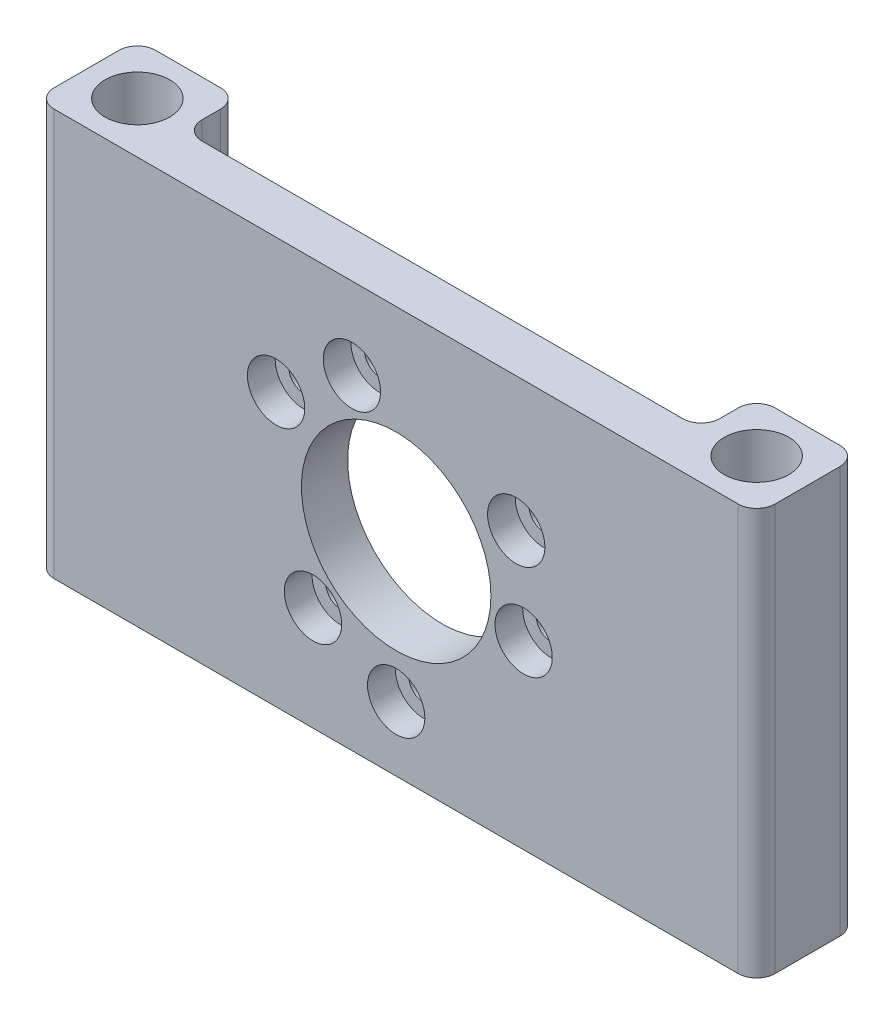
from build123d import *

# Parameters (mm, degrees)
ESQUISSE3_R                  = 3.5
BOSS_EXTRU_1_DEPTH           = 44
ESQUISSE4_R                  = 10.25
ESQUISSE4_R_2                = 1.625
ENL_V_MAT_EXTRU_1_DEPTH      = 60
ENL_V_MAT_EXTRU_2_DEPTH      = 60.816385715
ENL_V_MAT_EXTRU_2_DEPTH_BACK = 3
ESQUISSE6_R                  = 3.1


with BuildPart() as part:
    # Esquisse3 → Boss.-Extru.1 (new body)
    with BuildSketch(Plane(origin=(0, 0, 0), x_dir=(1, 0, 0), z_dir=(0, 1, 0))):
        with BuildLine():
            Line((26, 0), (-26, 0))
            ThreePointArc((-26, 0), (-27.414213562, 0.585786438), (-28, 2))
            Line((-28, 2), (-28, 4))
            ThreePointArc((-28, 4), (-28.585786438, 5.414213562), (-30, 6))
            Line((-30, 6), (-37, 6))
            ThreePointArc((-37, 6), (-38.414213562, 5.414213562), (-39, 4))
            Line((-39, 4), (-39, -3))
            ThreePointArc((-39, -3), (-38.414213562, -4.414213562), (-37, -5))
            Line((-37, -5), (37, -5))
            ThreePointArc((37, -5), (38.414213562, -4.414213562), (39, -3))
            Line((39, -3), (39, 4))
            ThreePointArc((39, 4), (38.414213562, 5.414213562), (37, 6))
            Line((37, 6), (30, 6))
            ThreePointArc((30, 6), (28.585786438, 5.414213562), (28, 4))
            Line((28, 4), (28, 2))
            ThreePointArc((28, 2), (27.414213562, 0.585786438), (26, 0))
        make_face()
        with Locations(Location((-33.5, 0.5, 0), (0, 0, 270))):
            Circle(ESQUISSE3_R, mode=Mode.SUBTRACT)
        with Locations(Location((33.5, 0.5, 0), (0, 0, 90))):
            Circle(ESQUISSE3_R, mode=Mode.SUBTRACT)
    extrude(amount=BOSS_EXTRU_1_DEPTH)

    # Esquisse4 → Enlèv. mat.-Extru.1 (cut)
    with BuildSketch(Plane.XY.offset(5)):
        with Locations((0, 22)):
            Circle(ESQUISSE4_R)
        with Locations((0, 7)):
            Circle(ESQUISSE4_R_2)
        with Locations((-8.999026536, 11.275377796)):
            Circle(ESQUISSE4_R_2)
        with Locations((13.787308542, 19.568925513)):
            Circle(ESQUISSE4_R_2)
        with Locations((12.990381057, 29.5)):
            Circle(ESQUISSE4_R_2)
        with Locations((-4.788282007, 35.155696691)):
            Circle(ESQUISSE4_R_2)
        with Locations((-12.990381057, 29.5)):
            Circle(ESQUISSE4_R_2)
    extrude(amount=-ENL_V_MAT_EXTRU_1_DEPTH, mode=Mode.SUBTRACT)

    # Esquisse6 → Enlèv. mat.-Extru.2 (cut, two sides: drawn at the far end of the back side and taken through both)
    with BuildSketch(Plane.XY.offset(5).offset(-ENL_V_MAT_EXTRU_2_DEPTH_BACK)):
        with Locations(Location((0, 7, 0), (0, 0, 180))):
            Circle(ESQUISSE6_R)
        with Locations(Location((-8.999026536, 11.275377796, 0), (0, 0, 180))):
            Circle(ESQUISSE6_R)
        with Locations(Location((-4.788282007, 35.155696691, 0), (0, 0, 180))):
            Circle(ESQUISSE6_R)
        with Locations(Location((-12.990381057, 29.5, 0), (0, 0, 180))):
            Circle(ESQUISSE6_R)
        with Locations(Location((13.787308542, 19.568925513, 0), (0, 0, 180))):
            Circle(ESQUISSE6_R)
        with Locations(Location((12.990381057, 29.5, 0), (0, 0, 180))):
            Circle(ESQUISSE6_R)
    extrude(amount=ENL_V_MAT_EXTRU_2_DEPTH + ENL_V_MAT_EXTRU_2_DEPTH_BACK, mode=Mode.SUBTRACT)


solid = part.part
